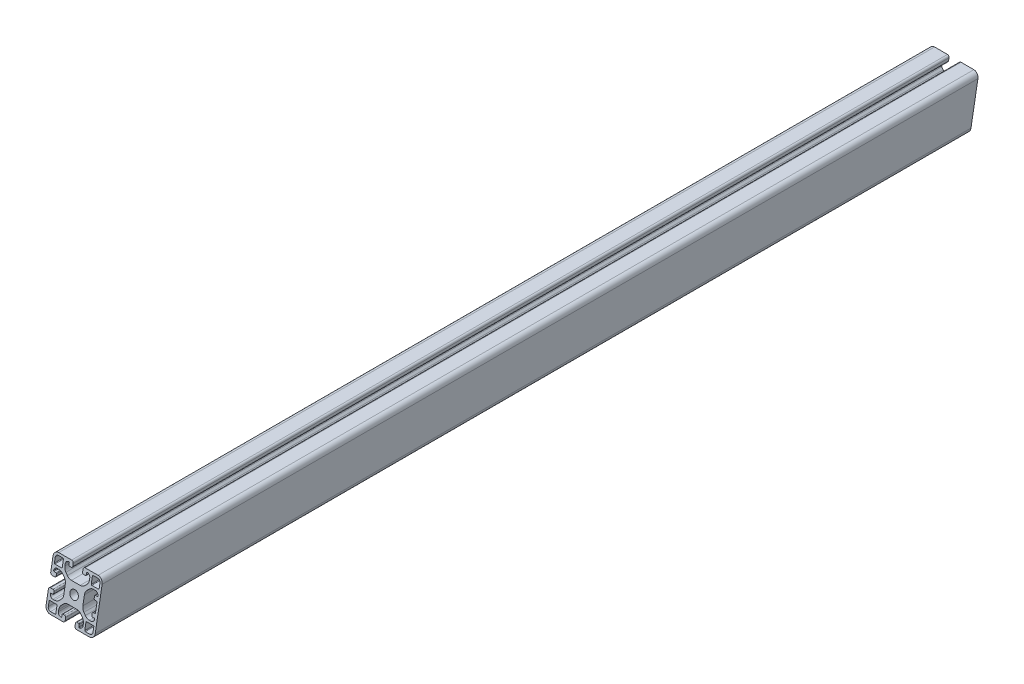
from build123d import *

# Parameters (mm, degrees)
SCHIZZO1_R                   = 3.4
ESTRUSIONE_ESTRUSIONE1_DEPTH = 720
TAGLIO_ESTRUSIONE4_DEPTH     = 383.622529394


with BuildPart() as part:
    # Schizzo1 → Estrusione-Estrusione1 (new body)
    with BuildSketch(Plane(origin=(0, 0, -340), x_dir=(-1, 0, 0), z_dir=(0, 0, -1))):
        with BuildLine():
            Line((6.5, -15.5), (5, -15.5))
            ThreePointArc((5, -15.5), (4.292893219, -15.792893219), (4, -16.5))
            Line((4, -16.5), (4, -18.5))
            ThreePointArc((4, -18.5), (4.439339828, -19.560660172), (5.5, -20))
            Line((5.5, -20), (16, -20))
            ThreePointArc((16, -20), (18.828427125, -18.828427125), (20, -16))
            Line((20, -16), (20, -5.5))
            ThreePointArc((20, -5.5), (19.560660172, -4.439339828), (18.5, -4))
            Line((18.5, -4), (16.5, -4))
            ThreePointArc((16.5, -4), (15.792893219, -4.292893219), (15.5, -5))
            Line((15.5, -5), (15.5, -6.5))
            ThreePointArc((15.5, -6.5), (15.646446609, -6.853553391), (16, -7))
            Line((16, -7), (17.55, -7))
            ThreePointArc((17.55, -7), (17.868198052, -7.131801948), (18, -7.45))
            Line((18, -7.45), (18, -7.5))
            ThreePointArc((18, -7.5), (17.267766953, -9.267766953), (15.5, -10))
            Line((15.5, -10), (14.192388155, -10))
            ThreePointArc((14.192388155, -10), (12.278970994, -9.619397663), (10.656854249, -8.535533906))
            Line((10.656854249, -8.535533906), (9.214466094, -7.09314575))
            ThreePointArc((9.214466094, -7.09314575), (8.130602337, -5.471029006), (7.75, -3.557611845))
            Line((7.75, -3.557611845), (7.75, 3.557611845))
            ThreePointArc((7.75, 3.557611845), (8.130602337, 5.471029006), (9.214466094, 7.09314575))
            Line((9.214466094, 7.09314575), (10.656854249, 8.535533906))
            ThreePointArc((10.656854249, 8.535533906), (12.278970994, 9.619397663), (14.192388155, 10))
            Line((14.192388155, 10), (15.5, 10))
            ThreePointArc((15.5, 10), (17.267766953, 9.267766953), (18, 7.5))
            Line((18, 7.5), (18, 7.45))
            ThreePointArc((18, 7.45), (17.868198052, 7.131801948), (17.55, 7))
            Line((17.55, 7), (16, 7))
            ThreePointArc((16, 7), (15.646446609, 6.853553391), (15.5, 6.5))
            Line((15.5, 6.5), (15.5, 5))
            ThreePointArc((15.5, 5), (15.792893219, 4.292893219), (16.5, 4))
            Line((16.5, 4), (18.5, 4))
            ThreePointArc((18.5, 4), (19.560660172, 4.439339828), (20, 5.5))
            Line((20, 5.5), (20, 16))
            ThreePointArc((20, 16), (18.828427125, 18.828427125), (16, 20))
            Line((16, 20), (5.5, 20))
            ThreePointArc((5.5, 20), (4.439339828, 19.560660172), (4, 18.5))
            Line((4, 18.5), (4, 16.5))
            ThreePointArc((4, 16.5), (4.292893219, 15.792893219), (5, 15.5))
            Line((5, 15.5), (6.5, 15.5))
            ThreePointArc((6.5, 15.5), (6.853553391, 15.646446609), (7, 16))
            Line((7, 16), (7, 17.55))
            ThreePointArc((7, 17.55), (7.131801948, 17.868198052), (7.45, 18))
            Line((7.45, 18), (7.5, 18))
            ThreePointArc((7.5, 18), (9.267766953, 17.267766953), (10, 15.5))
            Line((10, 15.5), (10, 14.192388155))
            ThreePointArc((10, 14.192388155), (9.619397663, 12.278970994), (8.535533906, 10.656854249))
            Line((8.535533906, 10.656854249), (7.09314575, 9.214466094))
            ThreePointArc((7.09314575, 9.214466094), (5.471029006, 8.130602337), (3.557611844, 7.75))
            Line((3.557611844, 7.75), (-3.557611845, 7.75))
            ThreePointArc((-3.557611845, 7.75), (-5.471029006, 8.130602337), (-7.09314575, 9.214466094))
            Line((-7.09314575, 9.214466094), (-8.535533906, 10.656854249))
            ThreePointArc((-8.535533906, 10.656854249), (-9.619397663, 12.278970994), (-10, 14.192388155))
            Line((-10, 14.192388155), (-10, 15.5))
            ThreePointArc((-10, 15.5), (-9.267766953, 17.267766953), (-7.5, 18))
            Line((-7.5, 18), (-7.45, 18))
            ThreePointArc((-7.45, 18), (-7.131801948, 17.868198052), (-7, 17.55))
            Line((-7, 17.55), (-7, 16))
            ThreePointArc((-7, 16), (-6.853553391, 15.646446609), (-6.5, 15.5))
            Line((-6.5, 15.5), (-5, 15.5))
            ThreePointArc((-5, 15.5), (-4.292893219, 15.792893219), (-4, 16.5))
            Line((-4, 16.5), (-4, 18.5))
            ThreePointArc((-4, 18.5), (-4.439339828, 19.560660172), (-5.5, 20))
            Line((-5.5, 20), (-16, 20))
            ThreePointArc((-16, 20), (-18.828427125, 18.828427125), (-20, 16))
            Line((-20, 16), (-20, -16))
            ThreePointArc((-20, -16), (-18.828427125, -18.828427125), (-16, -20))
            Line((-16, -20), (-5.5, -20))
            ThreePointArc((-5.5, -20), (-4.439339828, -19.560660172), (-4, -18.5))
            Line((-4, -18.5), (-4, -16.5))
            ThreePointArc((-4, -16.5), (-4.292893219, -15.792893219), (-5, -15.5))
            Line((-5, -15.5), (-6.5, -15.5))
            ThreePointArc((-6.5, -15.5), (-6.853553391, -15.646446609), (-7, -16))
            Line((-7, -16), (-7, -17.55))
            ThreePointArc((-7, -17.55), (-7.131801948, -17.868198052), (-7.45, -18))
            Line((-7.45, -18), (-7.5, -18))
            ThreePointArc((-7.5, -18), (-9.267766953, -17.267766953), (-10, -15.5))
            Line((-10, -15.5), (-10, -14.192388155))
            ThreePointArc((-10, -14.192388155), (-9.619397663, -12.278970994), (-8.535533906, -10.656854249))
            Line((-8.535533906, -10.656854249), (-7.09314575, -9.214466094))
            ThreePointArc((-7.09314575, -9.214466094), (-5.471029006, -8.130602337), (-3.557611845, -7.75))
            Line((-3.557611845, -7.75), (3.557611845, -7.75))
            ThreePointArc((3.557611845, -7.75), (5.471029006, -8.130602337), (7.09314575, -9.214466094))
            Line((7.09314575, -9.214466094), (8.535533906, -10.656854249))
            ThreePointArc((8.535533906, -10.656854249), (9.619397663, -12.278970994), (10, -14.192388155))
            Line((10, -14.192388155), (10, -15.5))
            ThreePointArc((10, -15.5), (9.267766953, -17.267766953), (7.5, -18))
            Line((7.5, -18), (7.45, -18))
            ThreePointArc((7.45, -18), (7.131801948, -17.868198052), (7, -17.55))
            Line((7, -17.55), (7, -16))
            ThreePointArc((7, -16), (6.853553391, -15.646446609), (6.5, -15.5))
        make_face()
        Circle(SCHIZZO1_R, mode=Mode.SUBTRACT)
        with BuildLine():
            Line((-12.3, -18.2), (-16, -18.2))
            ThreePointArc((-16, -18.2), (-17.555634919, -17.555634919), (-18.2, -16))
            Line((-18.2, -16), (-18.2, -12.3))
            ThreePointArc((-18.2, -12.3), (-18.053553391, -11.946446609), (-17.7, -11.8))
            Line((-17.7, -11.8), (-12.3, -11.8))
            ThreePointArc((-12.3, -11.8), (-11.946446609, -11.946446609), (-11.8, -12.3))
            Line((-11.8, -12.3), (-11.8, -17.7))
            ThreePointArc((-11.8, -17.7), (-11.946446609, -18.053553391), (-12.3, -18.2))
        make_face(mode=Mode.SUBTRACT)
        with BuildLine():
            Line((-11.8, 17.7), (-11.8, 12.3))
            ThreePointArc((-11.8, 12.3), (-11.946446609, 11.946446609), (-12.3, 11.8))
            Line((-12.3, 11.8), (-17.7, 11.8))
            ThreePointArc((-17.7, 11.8), (-18.053553391, 11.946446609), (-18.2, 12.3))
            Line((-18.2, 12.3), (-18.2, 16))
            ThreePointArc((-18.2, 16), (-17.555634919, 17.555634919), (-16, 18.2))
            Line((-16, 18.2), (-12.3, 18.2))
            ThreePointArc((-12.3, 18.2), (-11.946446609, 18.053553391), (-11.8, 17.7))
        make_face(mode=Mode.SUBTRACT)
        with BuildLine():
            Line((18.2, 16), (18.2, 12.3))
            ThreePointArc((18.2, 12.3), (18.053553391, 11.946446609), (17.7, 11.8))
            Line((17.7, 11.8), (12.3, 11.8))
            ThreePointArc((12.3, 11.8), (11.946446609, 11.946446609), (11.8, 12.3))
            Line((11.8, 12.3), (11.8, 17.7))
            ThreePointArc((11.8, 17.7), (11.946446609, 18.053553391), (12.3, 18.2))
            Line((12.3, 18.2), (16, 18.2))
            ThreePointArc((16, 18.2), (17.555634919, 17.555634919), (18.2, 16))
        make_face(mode=Mode.SUBTRACT)
        with BuildLine():
            Line((18.2, -12.3), (18.2, -16))
            ThreePointArc((18.2, -16), (17.555634919, -17.555634919), (16, -18.2))
            Line((16, -18.2), (12.3, -18.2))
            ThreePointArc((12.3, -18.2), (11.946446609, -18.053553391), (11.8, -17.7))
            Line((11.8, -17.7), (11.8, -12.3))
            ThreePointArc((11.8, -12.3), (11.946446609, -11.946446609), (12.3, -11.8))
            Line((12.3, -11.8), (17.7, -11.8))
            ThreePointArc((17.7, -11.8), (18.053553391, -11.946446609), (18.2, -12.3))
        make_face(mode=Mode.SUBTRACT)
        with BuildLine():
            Line((-16, 7), (-17.5, 7))
            ThreePointArc((-17.5, 7), (-17.853553391, 7.146446609), (-18, 7.5))
            ThreePointArc((-18, 7.5), (-17.267766953, 9.267766953), (-15.5, 10))
            Line((-15.5, 10), (-14.192388155, 10))
            ThreePointArc((-14.192388155, 10), (-12.278970994, 9.619397663), (-10.656854249, 8.535533906))
            Line((-10.656854249, 8.535533906), (-9.214466094, 7.093145751))
            ThreePointArc((-9.214466094, 7.093145751), (-8.130602337, 5.471029006), (-7.75, 3.557611845))
            Line((-7.75, 3.557611845), (-7.75, -3.557611845))
            ThreePointArc((-7.75, -3.557611845), (-8.130602337, -5.471029006), (-9.214466094, -7.093145751))
            Line((-9.214466094, -7.093145751), (-10.656854249, -8.535533906))
            ThreePointArc((-10.656854249, -8.535533906), (-12.278970994, -9.619397663), (-14.192388155, -10))
            Line((-14.192388155, -10), (-15.5, -10))
            ThreePointArc((-15.5, -10), (-17.267766953, -9.267766953), (-18, -7.5))
            ThreePointArc((-18, -7.5), (-17.853553391, -7.146446609), (-17.5, -7))
            Line((-17.5, -7), (-16, -7))
            ThreePointArc((-16, -7), (-15.646446609, -6.853553391), (-15.5, -6.5))
            Line((-15.5, -6.5), (-15.5, -5))
            ThreePointArc((-15.5, -5), (-15.792893219, -4.292893219), (-16.5, -4))
            Line((-16.5, -4), (-17.5, -4))
            ThreePointArc((-17.5, -4), (-17.853553391, -3.853553391), (-18, -3.5))
            Line((-18, -3.5), (-18, 3.5))
            ThreePointArc((-18, 3.5), (-17.853553391, 3.853553391), (-17.5, 4))
            Line((-17.5, 4), (-16.5, 4))
            ThreePointArc((-16.5, 4), (-15.792893219, 4.292893219), (-15.5, 5))
            Line((-15.5, 5), (-15.5, 6.5))
            ThreePointArc((-15.5, 6.5), (-15.646446609, 6.853553391), (-16, 7))
        make_face(mode=Mode.SUBTRACT)
    extrude(amount=-ESTRUSIONE_ESTRUSIONE1_DEPTH)

    # Schizzo9 → Taglio-Estrusione4 (cut, through all)
    with BuildSketch(Plane(origin=(20, 0, 0), x_dir=(0, 0, -1), z_dir=(1, 0, 0))):
        Polygon((340, -20), (340, 20), (332.946920772, -20), align=None)
        Polygon((-380, -20), (-372.9507443, 20), (-380, 20), align=None)
    extrude(amount=-TAGLIO_ESTRUSIONE4_DEPTH, mode=Mode.SUBTRACT)


solid = part.part
